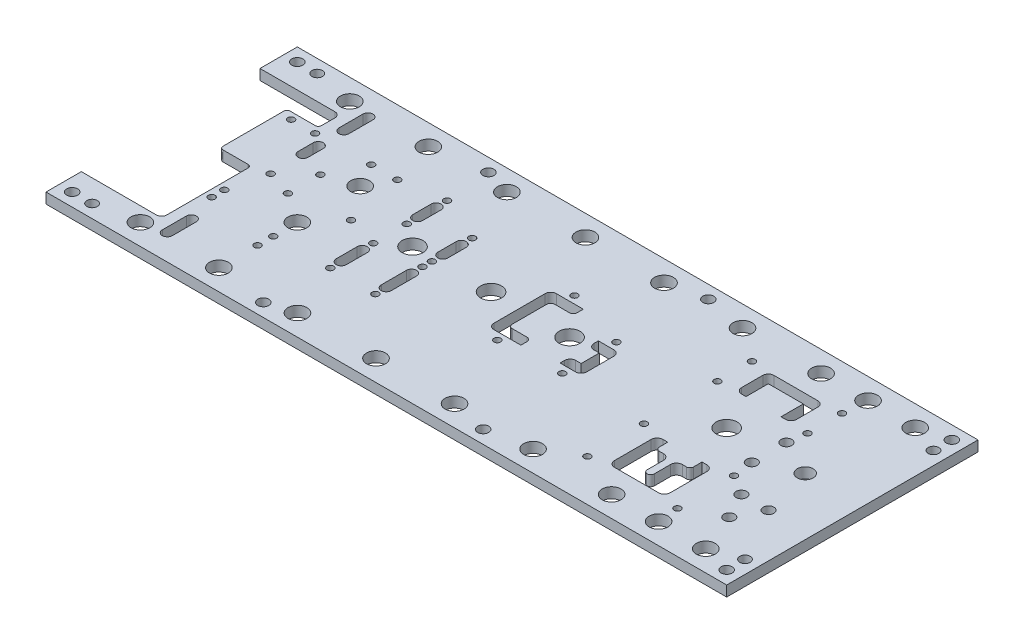
from build123d import *

# Parameters (mm, degrees)
SKETCH1_W                      = 650
SKETCH1_H                      = 240
BOSS_EXTRUDE1_DEPTH            = 10
CUT_EXTRUDE1_REACH             = 348.591
SKETCH2_R                      = 9
SKETCH2_R_2                    = 10
M6_CLEARANCE_HOLE1_D           = 6.4
M6_CLEARANCE_HOLE1_CSINK_D     = 6.45
M6_CLEARANCE_HOLE1_CSINK_ANGLE = 90
CUT_EXTRUDE2_REACH             = 348.591
FILLET1_R                      = 3
CUT_EXTRUDE3_REACH             = 348.591
SKETCH12_R                     = 5.113641914
SKETCH12_R_2                   = 7.613641914
CUT_EXTRUDE4_REACH             = 348.591
CUT_EXTRUDE5_REACH             = 348.591
CUT_EXTRUDE6_REACH             = 348.591
M10_CLEARANCE_HOLE1_D          = 10.5
F_10_0MM_DOWEL_HOLE1_D         = 10


with BuildPart() as part:
    # Sketch1 → Boss-Extrude1 (new body)
    with BuildSketch(Plane(origin=(0, 0, 0), x_dir=(1, 0, 0), z_dir=(0, 1, 0))):
        Rectangle(SKETCH1_W, SKETCH1_H)
    extrude(amount=-BOSS_EXTRUDE1_DEPTH)

    # Sketch2 → Cut-Extrude1 (cut, up to next)
    with BuildSketch(Plane.XZ.offset(10), mode=Mode.PRIVATE) as cut_extrude1_sk1:
        with Locations(Location((-254.87, -100, 0), (0, 0, 270))):
            Circle(SKETCH2_R)
    cut_extrude1_tool1 = extrude(cut_extrude1_sk1.sketch, amount=-CUT_EXTRUDE1_REACH, mode=Mode.PRIVATE) & part.part
    # Sketch2 → Cut-Extrude1 (cut, up to next)
    with BuildSketch(Plane.XZ.offset(10), mode=Mode.PRIVATE) as cut_extrude1_sk2:
        with Locations(Location((285, -100, 0), (0, 0, 270))):
            Circle(SKETCH2_R)
    cut_extrude1_tool2 = extrude(cut_extrude1_sk2.sketch, amount=-CUT_EXTRUDE1_REACH, mode=Mode.PRIVATE) & part.part
    # Sketch2 → Cut-Extrude1 (cut, up to next)
    with BuildSketch(Plane.XZ.offset(10), mode=Mode.PRIVATE) as cut_extrude1_sk3:
        with Locations(Location((120.13, 100, 0), (0, 0, 270))):
            Circle(SKETCH2_R)
    cut_extrude1_tool3 = extrude(cut_extrude1_sk3.sketch, amount=-CUT_EXTRUDE1_REACH, mode=Mode.PRIVATE) & part.part
    # Sketch2 → Cut-Extrude1 (cut, up to next)
    with BuildSketch(Plane.XZ.offset(10), mode=Mode.PRIVATE) as cut_extrude1_sk4:
        with Locations(Location((120.13, -100, 0), (0, 0, 270))):
            Circle(SKETCH2_R)
    cut_extrude1_tool4 = extrude(cut_extrude1_sk4.sketch, amount=-CUT_EXTRUDE1_REACH, mode=Mode.PRIVATE) & part.part
    # Sketch2 → Cut-Extrude1 (cut, up to next)
    with BuildSketch(Plane.XZ.offset(10), mode=Mode.PRIVATE) as cut_extrude1_sk5:
        with Locations(Location((45.13, 100, 0), (0, 0, 270))):
            Circle(SKETCH2_R)
    cut_extrude1_tool5 = extrude(cut_extrude1_sk5.sketch, amount=-CUT_EXTRUDE1_REACH, mode=Mode.PRIVATE) & part.part
    # Sketch2 → Cut-Extrude1 (cut, up to next)
    with BuildSketch(Plane.XZ.offset(10), mode=Mode.PRIVATE) as cut_extrude1_sk6:
        with Locations(Location((240, 100, 0), (0, 0, 270))):
            Circle(SKETCH2_R)
    cut_extrude1_tool6 = extrude(cut_extrude1_sk6.sketch, amount=-CUT_EXTRUDE1_REACH, mode=Mode.PRIVATE) & part.part
    # Sketch2 → Cut-Extrude1 (cut, up to next)
    with BuildSketch(Plane.XZ.offset(10), mode=Mode.PRIVATE) as cut_extrude1_sk7:
        with Locations(Location((240, -100, 0), (0, 0, 270))):
            Circle(SKETCH2_R)
    cut_extrude1_tool7 = extrude(cut_extrude1_sk7.sketch, amount=-CUT_EXTRUDE1_REACH, mode=Mode.PRIVATE) & part.part
    # Sketch2 → Cut-Extrude1 (cut, up to next)
    with BuildSketch(Plane.XZ.offset(10), mode=Mode.PRIVATE) as cut_extrude1_sk8:
        with Locations(Location((195.13, -100, 0), (0, 0, 270))):
            Circle(SKETCH2_R)
    cut_extrude1_tool8 = extrude(cut_extrude1_sk8.sketch, amount=-CUT_EXTRUDE1_REACH, mode=Mode.PRIVATE) & part.part
    # Sketch2 → Cut-Extrude1 (cut, up to next)
    with BuildSketch(Plane.XZ.offset(10), mode=Mode.PRIVATE) as cut_extrude1_sk9:
        with Locations(Location((285, 100, 0), (0, 0, 270))):
            Circle(SKETCH2_R)
    cut_extrude1_tool9 = extrude(cut_extrude1_sk9.sketch, amount=-CUT_EXTRUDE1_REACH, mode=Mode.PRIVATE) & part.part
    # Sketch2 → Cut-Extrude1 (cut, up to next)
    with BuildSketch(Plane.XZ.offset(10), mode=Mode.PRIVATE) as cut_extrude1_sk10:
        with Locations(Location((-104.87, -100, 0), (0, 0, 270))):
            Circle(SKETCH2_R)
    cut_extrude1_tool10 = extrude(cut_extrude1_sk10.sketch, amount=-CUT_EXTRUDE1_REACH, mode=Mode.PRIVATE) & part.part
    # Sketch2 → Cut-Extrude1 (cut, up to next)
    with BuildSketch(Plane.XZ.offset(10), mode=Mode.PRIVATE) as cut_extrude1_sk11:
        with Locations(Location((-179.87, 100, 0), (0, 0, 270))):
            Circle(SKETCH2_R)
    cut_extrude1_tool11 = extrude(cut_extrude1_sk11.sketch, amount=-CUT_EXTRUDE1_REACH, mode=Mode.PRIVATE) & part.part
    # Sketch2 → Cut-Extrude1 (cut, up to next)
    with BuildSketch(Plane.XZ.offset(10), mode=Mode.PRIVATE) as cut_extrude1_sk12:
        with Locations(Location((-179.87, -100, 0), (0, 0, 270))):
            Circle(SKETCH2_R)
    cut_extrude1_tool12 = extrude(cut_extrude1_sk12.sketch, amount=-CUT_EXTRUDE1_REACH, mode=Mode.PRIVATE) & part.part
    # Sketch2 → Cut-Extrude1 (cut, up to next)
    with BuildSketch(Plane.XZ.offset(10), mode=Mode.PRIVATE) as cut_extrude1_sk13:
        with Locations(Location((45.13, -100, 0), (0, 0, 270))):
            Circle(SKETCH2_R)
    cut_extrude1_tool13 = extrude(cut_extrude1_sk13.sketch, amount=-CUT_EXTRUDE1_REACH, mode=Mode.PRIVATE) & part.part
    # Sketch2 → Cut-Extrude1 (cut, up to next)
    with BuildSketch(Plane.XZ.offset(10), mode=Mode.PRIVATE) as cut_extrude1_sk14:
        with Locations(Location((-29.87, 100, 0), (0, 0, 270))):
            Circle(SKETCH2_R)
    cut_extrude1_tool14 = extrude(cut_extrude1_sk14.sketch, amount=-CUT_EXTRUDE1_REACH, mode=Mode.PRIVATE) & part.part
    # Sketch2 → Cut-Extrude1 (cut, up to next)
    with BuildSketch(Plane.XZ.offset(10), mode=Mode.PRIVATE) as cut_extrude1_sk15:
        with Locations(Location((-29.87, -100, 0), (0, 0, 270))):
            Circle(SKETCH2_R)
    cut_extrude1_tool15 = extrude(cut_extrude1_sk15.sketch, amount=-CUT_EXTRUDE1_REACH, mode=Mode.PRIVATE) & part.part
    # Sketch2 → Cut-Extrude1 (cut, up to next)
    with BuildSketch(Plane.XZ.offset(10), mode=Mode.PRIVATE) as cut_extrude1_sk16:
        with Locations(Location((-104.87, 100, 0), (0, 0, 270))):
            Circle(SKETCH2_R)
    cut_extrude1_tool16 = extrude(cut_extrude1_sk16.sketch, amount=-CUT_EXTRUDE1_REACH, mode=Mode.PRIVATE) & part.part
    # Sketch2 → Cut-Extrude1 (cut, up to next)
    with BuildSketch(Plane.XZ.offset(10), mode=Mode.PRIVATE) as cut_extrude1_sk17:
        with Locations(Location((195.13, 100, 0), (0, 0, 270))):
            Circle(SKETCH2_R)
    cut_extrude1_tool17 = extrude(cut_extrude1_sk17.sketch, amount=-CUT_EXTRUDE1_REACH, mode=Mode.PRIVATE) & part.part
    # Sketch2 → Cut-Extrude1 (cut, up to next)
    with BuildSketch(Plane.XZ.offset(10), mode=Mode.PRIVATE) as cut_extrude1_sk18:
        with Locations(Location((-254.87, 100, 0), (0, 0, 270))):
            Circle(SKETCH2_R)
    cut_extrude1_tool18 = extrude(cut_extrude1_sk18.sketch, amount=-CUT_EXTRUDE1_REACH, mode=Mode.PRIVATE) & part.part
    # Sketch2 → Cut-Extrude1 (cut, up to next)
    with BuildSketch(Plane.XZ.offset(10), mode=Mode.PRIVATE) as cut_extrude1_sk19:
        with Locations(Location((195.13, -9.86, 0), (0, 0, 270))):
            Circle(SKETCH2_R_2)
    cut_extrude1_tool19 = extrude(cut_extrude1_sk19.sketch, amount=-CUT_EXTRUDE1_REACH, mode=Mode.PRIVATE) & part.part
    # Sketch2 → Cut-Extrude1 (cut, up to next)
    with BuildSketch(Plane.XZ.offset(10), mode=Mode.PRIVATE) as cut_extrude1_sk20:
        with Locations(Location((45.13, -9.86, 0), (0, 0, 270))):
            Circle(SKETCH2_R_2)
    cut_extrude1_tool20 = extrude(cut_extrude1_sk20.sketch, amount=-CUT_EXTRUDE1_REACH, mode=Mode.PRIVATE) & part.part
    # Sketch2 → Cut-Extrude1 (cut, up to next)
    with BuildSketch(Plane.XZ.offset(10), mode=Mode.PRIVATE) as cut_extrude1_sk21:
        with Locations(Location((-29.87, -9.86, 0), (0, 0, 270))):
            Circle(SKETCH2_R_2)
    cut_extrude1_tool21 = extrude(cut_extrude1_sk21.sketch, amount=-CUT_EXTRUDE1_REACH, mode=Mode.PRIVATE) & part.part
    # Sketch2 → Cut-Extrude1 (cut, up to next)
    with BuildSketch(Plane.XZ.offset(10), mode=Mode.PRIVATE) as cut_extrude1_sk22:
        with Locations(Location((-104.87, -9.86, 0), (0, 0, 270))):
            Circle(SKETCH2_R_2)
    cut_extrude1_tool22 = extrude(cut_extrude1_sk22.sketch, amount=-CUT_EXTRUDE1_REACH, mode=Mode.PRIVATE) & part.part
    # Sketch2 → Cut-Extrude1 (cut, up to next)
    with BuildSketch(Plane.XZ.offset(10), mode=Mode.PRIVATE) as cut_extrude1_sk23:
        with Locations(Location((-179.87, 25.14, 0), (0, 0, 270))):
            Circle(SKETCH2_R)
    cut_extrude1_tool23 = extrude(cut_extrude1_sk23.sketch, amount=-CUT_EXTRUDE1_REACH, mode=Mode.PRIVATE) & part.part
    # Sketch2 → Cut-Extrude1 (cut, up to next)
    with BuildSketch(Plane.XZ.offset(10), mode=Mode.PRIVATE) as cut_extrude1_sk24:
        with Locations(Location((-179.87, -34.86, 0), (0, 0, 270))):
            Circle(SKETCH2_R)
    cut_extrude1_tool24 = extrude(cut_extrude1_sk24.sketch, amount=-CUT_EXTRUDE1_REACH, mode=Mode.PRIVATE) & part.part
    add(cut_extrude1_tool1.solids().sort_by_distance((-254.87, -10, -100))[0], mode=Mode.SUBTRACT)
    add(cut_extrude1_tool2.solids().sort_by_distance((285, -10, -100))[0], mode=Mode.SUBTRACT)
    add(cut_extrude1_tool3.solids().sort_by_distance((120.13, -10, 100))[0], mode=Mode.SUBTRACT)
    add(cut_extrude1_tool4.solids().sort_by_distance((120.13, -10, -100))[0], mode=Mode.SUBTRACT)
    add(cut_extrude1_tool5.solids().sort_by_distance((45.13, -10, 100))[0], mode=Mode.SUBTRACT)
    add(cut_extrude1_tool6.solids().sort_by_distance((240, -10, 100))[0], mode=Mode.SUBTRACT)
    add(cut_extrude1_tool7.solids().sort_by_distance((240, -10, -100))[0], mode=Mode.SUBTRACT)
    add(cut_extrude1_tool8.solids().sort_by_distance((195.13, -10, -100))[0], mode=Mode.SUBTRACT)
    add(cut_extrude1_tool9.solids().sort_by_distance((285, -10, 100))[0], mode=Mode.SUBTRACT)
    add(cut_extrude1_tool10.solids().sort_by_distance((-104.87, -10, -100))[0], mode=Mode.SUBTRACT)
    add(cut_extrude1_tool11.solids().sort_by_distance((-179.87, -10, 100))[0], mode=Mode.SUBTRACT)
    add(cut_extrude1_tool12.solids().sort_by_distance((-179.87, -10, -100))[0], mode=Mode.SUBTRACT)
    add(cut_extrude1_tool13.solids().sort_by_distance((45.13, -10, -100))[0], mode=Mode.SUBTRACT)
    add(cut_extrude1_tool14.solids().sort_by_distance((-29.87, -10, 100))[0], mode=Mode.SUBTRACT)
    add(cut_extrude1_tool15.solids().sort_by_distance((-29.87, -10, -100))[0], mode=Mode.SUBTRACT)
    add(cut_extrude1_tool16.solids().sort_by_distance((-104.87, -10, 100))[0], mode=Mode.SUBTRACT)
    add(cut_extrude1_tool17.solids().sort_by_distance((195.13, -10, 100))[0], mode=Mode.SUBTRACT)
    add(cut_extrude1_tool18.solids().sort_by_distance((-254.87, -10, 100))[0], mode=Mode.SUBTRACT)
    add(cut_extrude1_tool19.solids().sort_by_distance((195.13, -10, -9.86))[0], mode=Mode.SUBTRACT)
    add(cut_extrude1_tool20.solids().sort_by_distance((45.13, -10, -9.86))[0], mode=Mode.SUBTRACT)
    add(cut_extrude1_tool21.solids().sort_by_distance((-29.87, -10, -9.86))[0], mode=Mode.SUBTRACT)
    add(cut_extrude1_tool22.solids().sort_by_distance((-104.87, -10, -9.86))[0], mode=Mode.SUBTRACT)
    add(cut_extrude1_tool23.solids().sort_by_distance((-179.87, -10, 25.14))[0], mode=Mode.SUBTRACT)
    add(cut_extrude1_tool24.solids().sort_by_distance((-179.87, -10, -34.86))[0], mode=Mode.SUBTRACT)

    # M6 Clearance Hole1 (through all)
    with Locations(Plane(origin=(0, -10, 0), x_dir=(-1, 0, 0), z_dir=(0, -1, 0))):
        with Locations((-238.13, -26.14), (-152.13, -26.14), (-152.13, -80.14), (-238.13, -80.14), (-238.13, 77), (-152.13, 77), (-152.13, 44), (-238.13, 44), (-71.5, -23.486173195), (-71.5, 28.206173195), (-12.94, -26.986173195), (-12.94, 46.706173195), (83.37, 45.36), (83.37, 6.86), (126.37, 25.86), (126.37, 64.36), (83.37, -2.14), (126.37, -6.14), (126.37, -47.14), (83.37, -47.14), (156.12, 2.36), (208.37, -5.64), (208.37, 25.36), (192.37, 57.86), (167.37, 57.86), (179.87, -48.14), (179.87, -63.14), (241.62, -33.14), (241.62, -45.14), (232.87, 2.36), (267.87, 56.92), (245.000667118, 56.92)):
            CounterSinkHole(M6_CLEARANCE_HOLE1_D / 2, M6_CLEARANCE_HOLE1_CSINK_D / 2, counter_sink_angle=M6_CLEARANCE_HOLE1_CSINK_ANGLE)

    # Sketch8 → Cut-Extrude2 (cut, up to next)
    with BuildSketch(Plane(origin=(0, 0, 0), x_dir=(1, 0, 0), z_dir=(0, 1, 0)), mode=Mode.PRIVATE) as cut_extrude2_sk1:
        with BuildLine():
            Line((-325, -86.262387825), (-253.37, -86.262387825))
            ThreePointArc((-253.37, -86.262387825), (-249.834466094, -84.797921731), (-248.37, -81.262387825))
            Line((-248.37, -81.262387825), (-248.37, -3.64))
            ThreePointArc((-248.37, -3.64), (-249.248679656, -1.518679656), (-251.37, -0.64))
            Line((-251.37, -0.64), (-275.37, -0.64))
            ThreePointArc((-275.37, -0.64), (-277.491320344, 0.238679656), (-278.37, 2.36))
            Line((-278.37, 2.36), (-278.37, 63.48))
            Line((-278.37, 63.48), (-248.37, 63.48))
            Line((-248.37, 63.48), (-248.37, 79.36))
            ThreePointArc((-248.37, 79.36), (-249.834466094, 82.895533906), (-253.37, 84.36))
            Line((-253.37, 84.36), (-325, 84.36))
            Line((-325, 84.36), (-325, -86.262387825))
        make_face()
    cut_extrude2_tool1 = extrude(cut_extrude2_sk1.sketch, amount=-CUT_EXTRUDE2_REACH, mode=Mode.PRIVATE) & part.part
    add(cut_extrude2_tool1.solids().sort_by_distance((-290.751548, 0, 6.540426))[0], mode=Mode.SUBTRACT)

    # Fillet1
    fillet1_edges = [part.edges().sort_by_distance(p)[0] for p in [
        (-248.37, -5, -63.48),
        (-278.37, -5, -63.48),
    ]]
    fillet(fillet1_edges, radius=FILLET1_R)

    # Sketch12 → Cut-Extrude3 (cut, up to next)
    with BuildSketch(Plane.XZ.offset(10), mode=Mode.PRIVATE) as cut_extrude3_sk1:
        with Locations(Location((270.13, 62.64, 0), (0, 0, 270))):
            Circle(SKETCH12_R)
    cut_extrude3_tool1 = extrude(cut_extrude3_sk1.sketch, amount=-CUT_EXTRUDE3_REACH, mode=Mode.PRIVATE) & part.part
    # Sketch12 → Cut-Extrude3 (cut, up to next)
    with BuildSketch(Plane.XZ.offset(10), mode=Mode.PRIVATE) as cut_extrude3_sk2:
        with Locations(Location((283.13, 38.14, 0), (0, 0, 270))):
            Circle(SKETCH12_R)
    cut_extrude3_tool2 = extrude(cut_extrude3_sk2.sketch, amount=-CUT_EXTRUDE3_REACH, mode=Mode.PRIVATE) & part.part
    # Sketch12 → Cut-Extrude3 (cut, up to next)
    with BuildSketch(Plane.XZ.offset(10), mode=Mode.PRIVATE) as cut_extrude3_sk3:
        with Locations(Location((257.13, 38.14, 0), (0, 0, 270))):
            Circle(SKETCH12_R)
    cut_extrude3_tool3 = extrude(cut_extrude3_sk3.sketch, amount=-CUT_EXTRUDE3_REACH, mode=Mode.PRIVATE) & part.part
    # Sketch12 → Cut-Extrude3 (cut, up to next)
    with BuildSketch(Plane.XZ.offset(10), mode=Mode.PRIVATE) as cut_extrude3_sk4:
        with Locations(Location((270.13, -9.86, 0), (0, 0, 270))):
            Circle(SKETCH12_R_2)
    cut_extrude3_tool4 = extrude(cut_extrude3_sk4.sketch, amount=-CUT_EXTRUDE3_REACH, mode=Mode.PRIVATE) & part.part
    # Sketch12 → Cut-Extrude3 (cut, up to next)
    with BuildSketch(Plane.XZ.offset(10), mode=Mode.PRIVATE) as cut_extrude3_sk5:
        with Locations(Location((235.63, -26.36, 0), (0, 0, 270))):
            Circle(SKETCH12_R)
    cut_extrude3_tool5 = extrude(cut_extrude3_sk5.sketch, amount=-CUT_EXTRUDE3_REACH, mode=Mode.PRIVATE) & part.part
    # Sketch12 → Cut-Extrude3 (cut, up to next)
    with BuildSketch(Plane.XZ.offset(10), mode=Mode.PRIVATE) as cut_extrude3_sk6:
        with Locations(Location((235.63, 6.64, 0), (0, 0, 270))):
            Circle(SKETCH12_R)
    cut_extrude3_tool6 = extrude(cut_extrude3_sk6.sketch, amount=-CUT_EXTRUDE3_REACH, mode=Mode.PRIVATE) & part.part
    # Sketch12 → Cut-Extrude3 (cut, up to next)
    with BuildSketch(Plane.XZ.offset(10), mode=Mode.PRIVATE) as cut_extrude3_sk7:
        with BuildLine():
            Line((211.837653611, -45.067653611), (211.837653611, -66.347653611))
            Line((211.837653611, -66.347653611), (178.422346389, -66.347653611))
            Line((178.422346389, -66.347653611), (178.422346389, -45.067653611))
            Line((178.422346389, -45.067653611), (174.13, -45.067653611))
            ThreePointArc((174.13, -45.067653611), (170.38774598, -46.61774598), (168.837653611, -50.36))
            Line((168.837653611, -50.36), (168.837653611, -70.64))
            ThreePointArc((168.837653611, -70.64), (170.38774598, -74.38225402), (174.13, -75.932346389))
            Line((174.13, -75.932346389), (195.13, -75.932346389))
            Line((195.13, -75.932346389), (216.13, -75.932346389))
            ThreePointArc((216.13, -75.932346389), (219.87225402, -74.38225402), (221.422346389, -70.64))
            Line((221.422346389, -70.64), (221.422346389, -50.36))
            ThreePointArc((221.422346389, -50.36), (219.87225402, -46.61774598), (216.13, -45.067653611))
            Line((216.13, -45.067653611), (211.837653611, -45.067653611))
        make_face()
    cut_extrude3_tool7 = extrude(cut_extrude3_sk7.sketch, amount=-CUT_EXTRUDE3_REACH, mode=Mode.PRIVATE) & part.part
    # Sketch12 → Cut-Extrude3 (cut, up to next)
    with BuildSketch(Plane.XZ.offset(10), mode=Mode.PRIVATE) as cut_extrude3_sk8:
        with BuildLine():
            Line((211.516358086, 30.026358086), (216.13, 30.026358086))
            ThreePointArc((216.13, 30.026358086), (220.099444264, 31.670555736), (221.743641914, 35.64))
            Line((221.743641914, 35.64), (221.743641914, 53.14))
            Line((221.743641914, 53.14), (221.743641914, 70.64))
            ThreePointArc((221.743641914, 70.64), (220.099444264, 74.609444264), (216.13, 76.253641914))
            Line((216.13, 76.253641914), (174.13, 76.253641914))
            ThreePointArc((174.13, 76.253641914), (170.160555736, 74.609444264), (168.516358086, 70.64))
            Line((168.516358086, 70.64), (168.516358086, 35.64))
            ThreePointArc((168.516358086, 35.64), (170.160555736, 31.670555736), (174.13, 30.026358086))
            Line((174.13, 30.026358086), (178.743641914, 30.026358086))
            Line((178.743641914, 30.026358086), (178.743641914, 38.14))
            ThreePointArc((178.743641914, 38.14), (179.735483234, 40.534516766), (182.13, 41.526358086))
            Line((182.13, 41.526358086), (186.13, 41.526358086))
            ThreePointArc((186.13, 41.526358086), (190.099444264, 43.170555736), (191.743641914, 47.14))
            Line((191.743641914, 47.14), (191.743641914, 62.64))
            ThreePointArc((191.743641914, 62.64), (195.13, 66.026358086), (198.516358086, 62.64))
            Line((198.516358086, 62.64), (198.516358086, 47.14))
            ThreePointArc((198.516358086, 47.14), (200.160555736, 43.170555736), (204.13, 41.526358086))
            Line((204.13, 41.526358086), (208.13, 41.526358086))
            ThreePointArc((208.13, 41.526358086), (210.524516766, 40.534516766), (211.516358086, 38.14))
            Line((211.516358086, 38.14), (211.516358086, 30.026358086))
        make_face()
    cut_extrude3_tool8 = extrude(cut_extrude3_sk8.sketch, amount=-CUT_EXTRUDE3_REACH, mode=Mode.PRIVATE) & part.part
    add(cut_extrude3_tool1.solids().sort_by_distance((270.13, -10, 62.64))[0], mode=Mode.SUBTRACT)
    add(cut_extrude3_tool2.solids().sort_by_distance((283.13, -10, 38.14))[0], mode=Mode.SUBTRACT)
    add(cut_extrude3_tool3.solids().sort_by_distance((257.13, -10, 38.14))[0], mode=Mode.SUBTRACT)
    add(cut_extrude3_tool4.solids().sort_by_distance((270.13, -10, -9.86))[0], mode=Mode.SUBTRACT)
    add(cut_extrude3_tool5.solids().sort_by_distance((235.63, -10, -26.36))[0], mode=Mode.SUBTRACT)
    add(cut_extrude3_tool6.solids().sort_by_distance((235.63, -10, 6.64))[0], mode=Mode.SUBTRACT)
    add(cut_extrude3_tool7.solids().sort_by_distance((205.63, -10, -75.32261))[0], mode=Mode.SUBTRACT)
    add(cut_extrude3_tool8.solids().sort_by_distance((206.13, -10, 42.231348))[0], mode=Mode.SUBTRACT)

    # Sketch13 → Cut-Extrude4 (cut, up to next)
    with BuildSketch(Plane.XZ.offset(10), mode=Mode.PRIVATE) as cut_extrude4_sk1:
        with BuildLine():
            Line((61.837653611, 15.932346389), (61.837653611, 11.64))
            ThreePointArc((61.837653611, 11.64), (63.38774598, 7.89774598), (67.13, 6.347653611))
            Line((67.13, 6.347653611), (72.337653611, 6.347653611))
            Line((72.337653611, 6.347653611), (72.337653611, -11.067653611))
            Line((72.337653611, -11.067653611), (67.13, -11.067653611))
            ThreePointArc((67.13, -11.067653611), (63.38774598, -12.61774598), (61.837653611, -16.36))
            Line((61.837653611, -16.36), (61.837653611, -20.652346389))
            Line((61.837653611, -20.652346389), (76.63, -20.652346389))
            ThreePointArc((76.63, -20.652346389), (80.37225402, -19.10225402), (81.922346389, -15.36))
            Line((81.922346389, -15.36), (81.922346389, -2.36))
            Line((81.922346389, -2.36), (81.922346389, 10.64))
            ThreePointArc((81.922346389, 10.64), (80.37225402, 14.38225402), (76.63, 15.932346389))
            Line((76.63, 15.932346389), (61.837653611, 15.932346389))
        make_face()
    cut_extrude4_tool1 = extrude(cut_extrude4_sk1.sketch, amount=-CUT_EXTRUDE4_REACH, mode=Mode.PRIVATE) & part.part
    # Sketch13 → Cut-Extrude4 (cut, up to next)
    with BuildSketch(Plane.XZ.offset(10), mode=Mode.PRIVATE) as cut_extrude4_sk2:
        with BuildLine():
            Line((2.63, -39.652346389), (28.422346389, -39.652346389))
            Line((28.422346389, -39.652346389), (28.422346389, -33.86))
            ThreePointArc((28.422346389, -33.86), (27.311593849, -31.178406151), (24.63, -30.067653611))
            Line((24.63, -30.067653611), (10.63, -30.067653611))
            ThreePointArc((10.63, -30.067653611), (8.00829299, -28.98170701), (6.922346389, -26.36))
            Line((6.922346389, -26.36), (6.922346389, 6.64))
            ThreePointArc((6.922346389, 6.64), (8.00829299, 9.26170701), (10.63, 10.347653611))
            Line((10.63, 10.347653611), (24.63, 10.347653611))
            ThreePointArc((24.63, 10.347653611), (27.311593849, 11.458406151), (28.422346389, 14.14))
            Line((28.422346389, 14.14), (28.422346389, 19.932346389))
            Line((28.422346389, 19.932346389), (2.63, 19.932346389))
            ThreePointArc((2.63, 19.932346389), (-1.11225402, 18.38225402), (-2.662346389, 14.64))
            Line((-2.662346389, 14.64), (-2.662346389, -13.23))
            Line((-2.662346389, -13.23), (-2.662346389, -34.36))
            ThreePointArc((-2.662346389, -34.36), (-1.11225402, -38.10225402), (2.63, -39.652346389))
        make_face()
    cut_extrude4_tool2 = extrude(cut_extrude4_sk2.sketch, amount=-CUT_EXTRUDE4_REACH, mode=Mode.PRIVATE) & part.part
    add(cut_extrude4_tool1.solids().sort_by_distance((73.54007, -10, -2.36))[0], mode=Mode.SUBTRACT)
    add(cut_extrude4_tool2.solids().sort_by_distance((-0.637039, -10, -37.627039))[0], mode=Mode.SUBTRACT)

    # Sketch14 → Cut-Extrude5 (cut, up to next)
    with BuildSketch(Plane.XZ.offset(10), mode=Mode.PRIVATE) as cut_extrude5_sk1:
        with BuildLine():
            Line((-88.162346389, -17.31), (-88.162346389, -34.91))
            ThreePointArc((-88.162346389, -34.91), (-83.37, -39.702346389), (-78.577653611, -34.91))
            Line((-78.577653611, -34.91), (-78.577653611, -26.11))
            Line((-78.577653611, -26.11), (-78.577653611, -17.31))
            ThreePointArc((-78.577653611, -17.31), (-83.37, -12.517653611), (-88.162346389, -17.31))
        make_face()
    cut_extrude5_tool1 = extrude(cut_extrude5_sk1.sketch, amount=-CUT_EXTRUDE5_REACH, mode=Mode.PRIVATE) & part.part
    # Sketch14 → Cut-Extrude5 (cut, up to next)
    with BuildSketch(Plane.XZ.offset(10), mode=Mode.PRIVATE) as cut_extrude5_sk2:
        with BuildLine():
            Line((-78.577653611, 12.59), (-78.577653611, 24.64))
            Line((-78.577653611, 24.64), (-78.577653611, 36.69))
            ThreePointArc((-78.577653611, 36.69), (-83.37, 41.482346389), (-88.162346389, 36.69))
            Line((-88.162346389, 36.69), (-88.162346389, 12.59))
            ThreePointArc((-88.162346389, 12.59), (-83.37, 7.797653611), (-78.577653611, 12.59))
        make_face()
    cut_extrude5_tool2 = extrude(cut_extrude5_sk2.sketch, amount=-CUT_EXTRUDE5_REACH, mode=Mode.PRIVATE) & part.part
    # Sketch14 → Cut-Extrude5 (cut, up to next)
    with BuildSketch(Plane.XZ.offset(10), mode=Mode.PRIVATE) as cut_extrude5_sk3:
        with BuildLine():
            Line((-131.232166649, 36.69), (-131.232166649, 16.59))
            ThreePointArc((-131.232166649, 16.59), (-126.37, 11.727833351), (-121.507833351, 16.59))
            Line((-121.507833351, 16.59), (-121.507833351, 26.64))
            Line((-121.507833351, 26.64), (-121.507833351, 36.69))
            ThreePointArc((-121.507833351, 36.69), (-126.37, 41.552166649), (-131.232166649, 36.69))
        make_face()
    cut_extrude5_tool3 = extrude(cut_extrude5_sk3.sketch, amount=-CUT_EXTRUDE5_REACH, mode=Mode.PRIVATE) & part.part
    # Sketch14 → Cut-Extrude5 (cut, up to next)
    with BuildSketch(Plane.XZ.offset(10), mode=Mode.PRIVATE) as cut_extrude5_sk4:
        with BuildLine():
            Line((-131.162346389, -36.31), (-131.162346389, -53.91))
            ThreePointArc((-131.162346389, -53.91), (-126.37, -58.702346389), (-121.577653611, -53.91))
            Line((-121.577653611, -53.91), (-121.577653611, -45.11))
            Line((-121.577653611, -45.11), (-121.577653611, -36.31))
            ThreePointArc((-121.577653611, -36.31), (-126.37, -31.517653611), (-131.162346389, -36.31))
        make_face()
    cut_extrude5_tool4 = extrude(cut_extrude5_sk4.sketch, amount=-CUT_EXTRUDE5_REACH, mode=Mode.PRIVATE) & part.part
    add(cut_extrude5_tool1.solids().sort_by_distance((-83.37, -10, -26.11))[0], mode=Mode.SUBTRACT)
    add(cut_extrude5_tool2.solids().sort_by_distance((-83.37, -10, 24.64))[0], mode=Mode.SUBTRACT)
    add(cut_extrude5_tool3.solids().sort_by_distance((-126.37, -10, 26.64))[0], mode=Mode.SUBTRACT)
    add(cut_extrude5_tool4.solids().sort_by_distance((-126.37, -10, -45.11))[0], mode=Mode.SUBTRACT)

    # Sketch15 → Cut-Extrude6 (cut, up to next)
    with BuildSketch(Plane.XZ.offset(10), mode=Mode.PRIVATE) as cut_extrude6_sk1:
        with BuildLine():
            Line((-228.577653611, -95.77), (-228.577653611, -84.32))
            Line((-228.577653611, -84.32), (-228.577653611, -72.87))
            ThreePointArc((-228.577653611, -72.87), (-233.37, -68.077653611), (-238.162346389, -72.87))
            Line((-238.162346389, -72.87), (-238.162346389, -95.77))
            ThreePointArc((-238.162346389, -95.77), (-233.37, -100.562346389), (-228.577653611, -95.77))
        make_face()
    cut_extrude6_tool1 = extrude(cut_extrude6_sk1.sketch, amount=-CUT_EXTRUDE6_REACH, mode=Mode.PRIVATE) & part.part
    # Sketch15 → Cut-Extrude6 (cut, up to next)
    with BuildSketch(Plane.XZ.offset(10), mode=Mode.PRIVATE) as cut_extrude6_sk2:
        with BuildLine():
            Line((-238.162346389, -33.86), (-238.162346389, -48.36))
            ThreePointArc((-238.162346389, -48.36), (-233.37, -53.152346389), (-228.577653611, -48.36))
            Line((-228.577653611, -48.36), (-228.577653611, -41.11))
            Line((-228.577653611, -41.11), (-228.577653611, -33.86))
            ThreePointArc((-228.577653611, -33.86), (-233.37, -29.067653611), (-238.162346389, -33.86))
        make_face()
    cut_extrude6_tool2 = extrude(cut_extrude6_sk2.sketch, amount=-CUT_EXTRUDE6_REACH, mode=Mode.PRIVATE) & part.part
    # Sketch15 → Cut-Extrude6 (cut, up to next)
    with BuildSketch(Plane.XZ.offset(10), mode=Mode.PRIVATE) as cut_extrude6_sk3:
        with BuildLine():
            Line((-238.162346389, 95.77), (-238.162346389, 72.87))
            ThreePointArc((-238.162346389, 72.87), (-233.37, 68.077653611), (-228.577653611, 72.87))
            Line((-228.577653611, 72.87), (-228.577653611, 84.32))
            Line((-228.577653611, 84.32), (-228.577653611, 95.77))
            ThreePointArc((-228.577653611, 95.77), (-233.37, 100.562346389), (-238.162346389, 95.77))
        make_face()
    cut_extrude6_tool3 = extrude(cut_extrude6_sk3.sketch, amount=-CUT_EXTRUDE6_REACH, mode=Mode.PRIVATE) & part.part
    add(cut_extrude6_tool1.solids().sort_by_distance((-233.37, -10, -84.32))[0], mode=Mode.SUBTRACT)
    add(cut_extrude6_tool2.solids().sort_by_distance((-233.37, -10, -41.11))[0], mode=Mode.SUBTRACT)
    add(cut_extrude6_tool3.solids().sort_by_distance((-233.37, -10, 84.32))[0], mode=Mode.SUBTRACT)

    # M10 Clearance Hole1 (through all)
    with Locations(Plane(origin=(0, -10, 0), x_dir=(-1, 0, 0), z_dir=(0, -1, 0))):
        with Locations((-312.5, 107.5), (-312.5, -107.5), (-80, 107.5), (130, 107.5), (312.5, 107.5), (312.5, -107.5), (130, -107.5), (-80, -107.5)):
            Hole(M10_CLEARANCE_HOLE1_D / 2)

    # Ø10.0mm Dowel Hole1 (through all)
    with Locations(Plane(origin=(0, -10, 0), x_dir=(-1, 0, 0), z_dir=(0, -1, 0))):
        with Locations((-312.5, 90), (-312.5, -90), (293.5, -107.5), (293.5, 107.5)):
            Hole(F_10_0MM_DOWEL_HOLE1_D / 2)


solid = part.part
